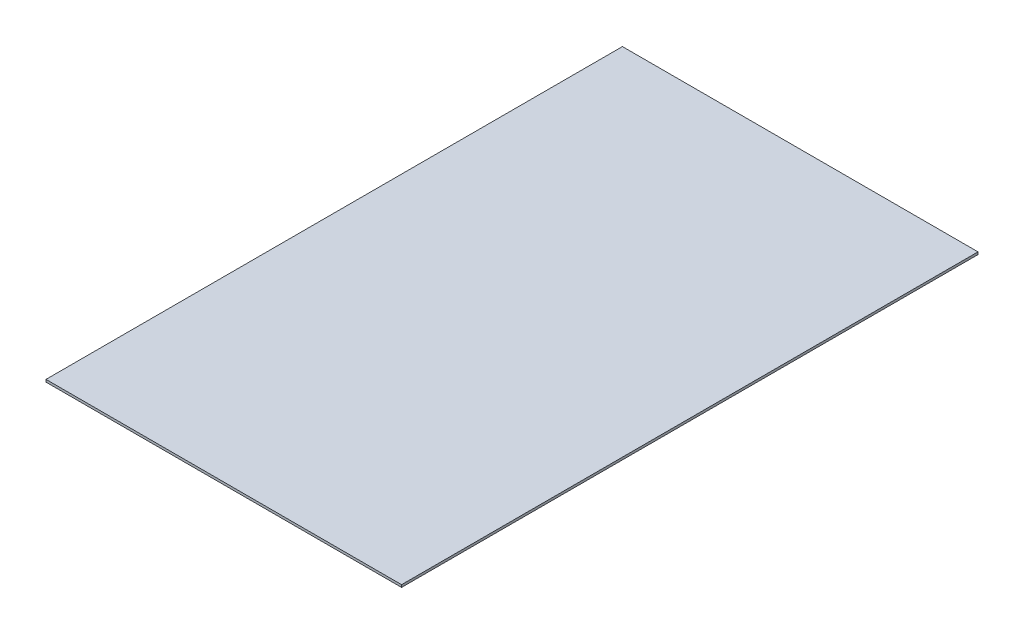
from build123d import *

# Parameters (mm, degrees)
SKETCH1_W           = 325.2
SKETCH1_H           = 527.2
BOSS_EXTRUDE1_DEPTH = 2.2


with BuildPart() as part:
    # Sketch1 → Boss-Extrude1 (new body)
    with BuildSketch(Plane(origin=(0, 0, 0), x_dir=(1, 0, 0), z_dir=(0, 1, 0))):
        Rectangle(SKETCH1_W, SKETCH1_H)
    extrude(amount=BOSS_EXTRUDE1_DEPTH)


solid = part.part
